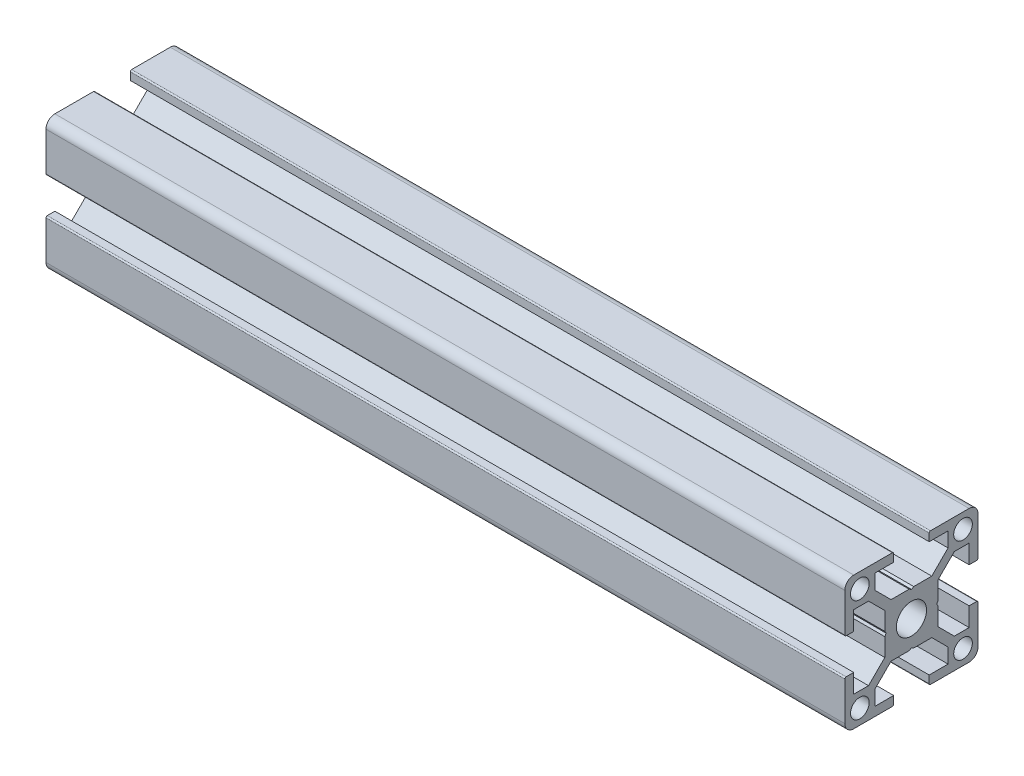
from build123d import *

# Parameters (mm, degrees)
SKETCH_1_R              = 2.1
SKETCH_1_R_2            = 3.4
F_30XS6_30X30S6_1_DEPTH = 180


with BuildPart() as part:
    # 草图1 → 30xs6 30X30S6(1) (new body)
    with BuildSketch(Plane.YZ):
        with BuildLine():
            Line((-14.7, 4), (-13, 4))
            Line((-13, 4), (-13, 8.25))
            Line((-13, 8.25), (-9.664213562, 8.25))
            Line((-9.664213562, 8.25), (-6, 4.585786438))
            Line((-6, 4.585786438), (-6, 0.519615242))
            Line((-6, 0.519615242), (-5.7, 0))
            Line((-5.7, 0), (-6, -0.519615242))
            Line((-6, -0.519615242), (-6, -4.585786438))
            Line((-6, -4.585786438), (-9.664213562, -8.25))
            Line((-9.664213562, -8.25), (-13, -8.25))
            Line((-13, -8.25), (-13, -4))
            Line((-13, -4), (-14.7, -4))
            ThreePointArc((-14.7, -4), (-14.912132034, -4.087867966), (-15, -4.3))
            Line((-15, -4.3), (-15, -13))
            ThreePointArc((-15, -13), (-14.414213562, -14.414213562), (-13, -15))
            Line((-13, -15), (-4.3, -15))
            ThreePointArc((-4.3, -15), (-4.087867966, -14.912132034), (-4, -14.7))
            Line((-4, -14.7), (-4, -13))
            Line((-4, -13), (-8.25, -13))
            Line((-8.25, -13), (-8.25, -9.664213562))
            Line((-8.25, -9.664213562), (-4.585786438, -6))
            Line((-4.585786438, -6), (-0.519615242, -6))
            Line((-0.519615242, -6), (0, -5.7))
            Line((0, -5.7), (0.519615242, -6))
            Line((0.519615242, -6), (4.585786438, -6))
            Line((4.585786438, -6), (8.25, -9.664213562))
            Line((8.25, -9.664213562), (8.25, -13))
            Line((8.25, -13), (4, -13))
            Line((4, -13), (4, -14.7))
            ThreePointArc((4, -14.7), (4.087867966, -14.912132034), (4.3, -15))
            Line((4.3, -15), (13, -15))
            ThreePointArc((13, -15), (14.414213562, -14.414213562), (15, -13))
            Line((15, -13), (15, -4.3))
            ThreePointArc((15, -4.3), (14.912132034, -4.087867966), (14.7, -4))
            Line((14.7, -4), (13, -4))
            Line((13, -4), (13, -8.25))
            Line((13, -8.25), (9.664213562, -8.25))
            Line((9.664213562, -8.25), (6, -4.585786438))
            Line((6, -4.585786438), (6, -0.519615242))
            Line((6, -0.519615242), (5.7, 0))
            Line((5.7, 0), (6, 0.519615242))
            Line((6, 0.519615242), (6, 4.585786438))
            Line((6, 4.585786438), (9.664213562, 8.25))
            Line((9.664213562, 8.25), (13, 8.25))
            Line((13, 8.25), (13, 4))
            Line((13, 4), (14.7, 4))
            ThreePointArc((14.7, 4), (14.912132034, 4.087867966), (15, 4.3))
            Line((15, 4.3), (15, 13))
            ThreePointArc((15, 13), (14.414213562, 14.414213562), (13, 15))
            Line((13, 15), (4.3, 15))
            ThreePointArc((4.3, 15), (4.087867966, 14.912132034), (4, 14.7))
            Line((4, 14.7), (4, 13))
            Line((4, 13), (8.25, 13))
            Line((8.25, 13), (8.25, 9.664213562))
            Line((8.25, 9.664213562), (4.585786438, 6))
            Line((4.585786438, 6), (0.519615242, 6))
            Line((0.519615242, 6), (0, 5.7))
            Line((0, 5.7), (-0.519615242, 6))
            Line((-0.519615242, 6), (-4.585786438, 6))
            Line((-4.585786438, 6), (-8.25, 9.664213562))
            Line((-8.25, 9.664213562), (-8.25, 13))
            Line((-8.25, 13), (-4, 13))
            Line((-4, 13), (-4, 14.7))
            ThreePointArc((-4, 14.7), (-4.087867966, 14.912132034), (-4.3, 15))
            Line((-4.3, 15), (-13, 15))
            ThreePointArc((-13, 15), (-14.414213562, 14.414213562), (-15, 13))
            Line((-15, 13), (-15, 4.3))
            ThreePointArc((-15, 4.3), (-14.912132034, 4.087867966), (-14.7, 4))
        make_face()
        with Locations((11.625, 11.625)):
            Circle(SKETCH_1_R, mode=Mode.SUBTRACT)
        with Locations((11.625, -11.625)):
            Circle(SKETCH_1_R, mode=Mode.SUBTRACT)
        Circle(SKETCH_1_R_2, mode=Mode.SUBTRACT)
        with Locations((-11.625, -11.625)):
            Circle(SKETCH_1_R, mode=Mode.SUBTRACT)
        with Locations((-11.625, 11.625)):
            Circle(SKETCH_1_R, mode=Mode.SUBTRACT)
    extrude(amount=F_30XS6_30X30S6_1_DEPTH)


solid = part.part
